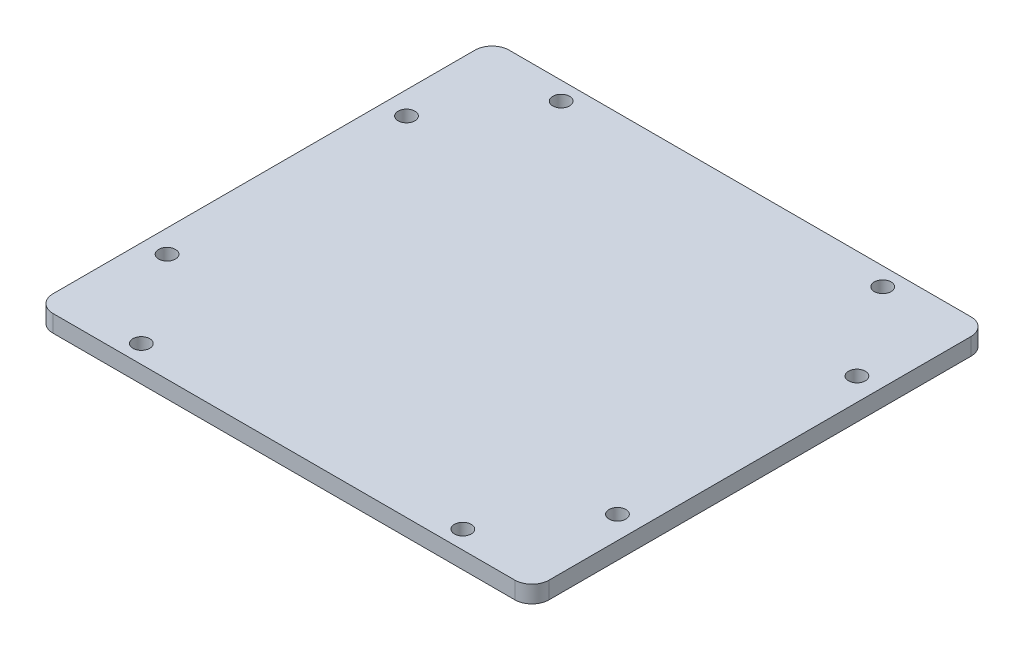
from build123d import *

# Parameters (mm, degrees)
SKETCH1_R           = 1.475
BOSS_EXTRUDE1_DEPTH = 3


with BuildPart() as part:
    # Sketch1 → Boss-Extrude1 (new body)
    with BuildSketch(Plane(origin=(0, 0, 0), x_dir=(1, 0, 0), z_dir=(0, 1, 0))):
        with BuildLine():
            Line((-40.5, 40), (40.5, 40))
            ThreePointArc((40.5, 40), (42.621320344, 39.121320344), (43.5, 37))
            Line((43.5, 37), (43.5, -37))
            ThreePointArc((43.5, -37), (42.621320344, -39.121320344), (40.5, -40))
            Line((40.5, -40), (-40.5, -40))
            ThreePointArc((-40.5, -40), (-42.621320344, -39.121320344), (-43.5, -37))
            Line((-43.5, -37), (-43.5, 37))
            ThreePointArc((-43.5, 37), (-42.621320344, 39.121320344), (-40.5, 40))
        make_face()
        with Locations(Location((28.198, -36.819, 0), (0, 0, 270))):
            Circle(SKETCH1_R, mode=Mode.SUBTRACT)
        with Locations(Location((28.198, 36.819, 0), (0, 0, 90))):
            Circle(SKETCH1_R, mode=Mode.SUBTRACT)
        with Locations(Location((-28.198, 36.819, 0), (0, 0, 270))):
            Circle(SKETCH1_R, mode=Mode.SUBTRACT)
        with Locations(Location((-28.198, -36.819, 0), (0, 0, 90))):
            Circle(SKETCH1_R, mode=Mode.SUBTRACT)
        with Locations(Location((39.5, 21, 0), (0, 0, 270))):
            Circle(SKETCH1_R, mode=Mode.SUBTRACT)
        with Locations(Location((-39.5, 21, 0), (0, 0, 90))):
            Circle(SKETCH1_R, mode=Mode.SUBTRACT)
        with Locations(Location((39.5, -21, 0), (0, 0, 90))):
            Circle(SKETCH1_R, mode=Mode.SUBTRACT)
        with Locations(Location((-39.5, -21, 0), (0, 0, 270))):
            Circle(SKETCH1_R, mode=Mode.SUBTRACT)
    extrude(amount=BOSS_EXTRUDE1_DEPTH)


solid = part.part
